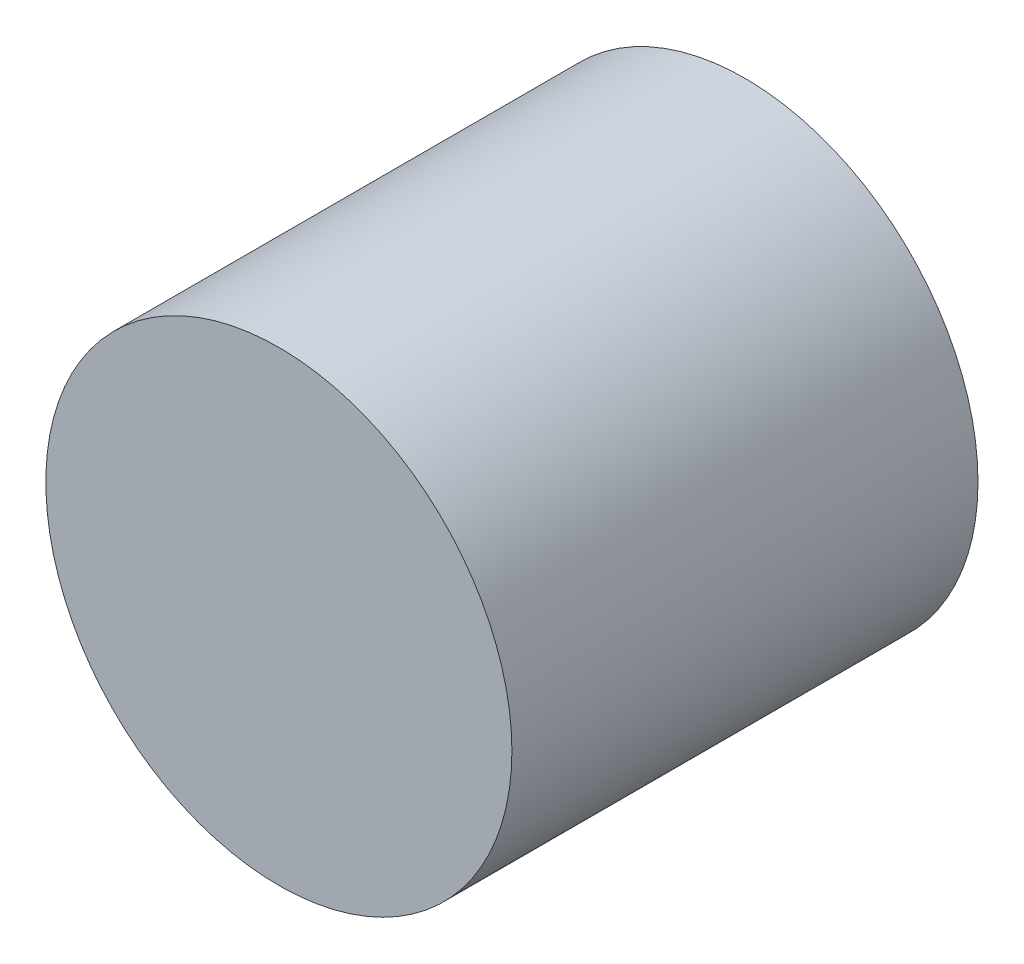
from build123d import *

# Parameters (mm, degrees)
SKETCH_1_R = 1.5
M3X3_DEPTH = 3


with BuildPart() as part:
    # 草图1 → M3x3螺钉包络 (new body)
    with BuildSketch(Plane.XY):
        Circle(SKETCH_1_R)
    extrude(amount=M3X3_DEPTH)


solid = part.part
